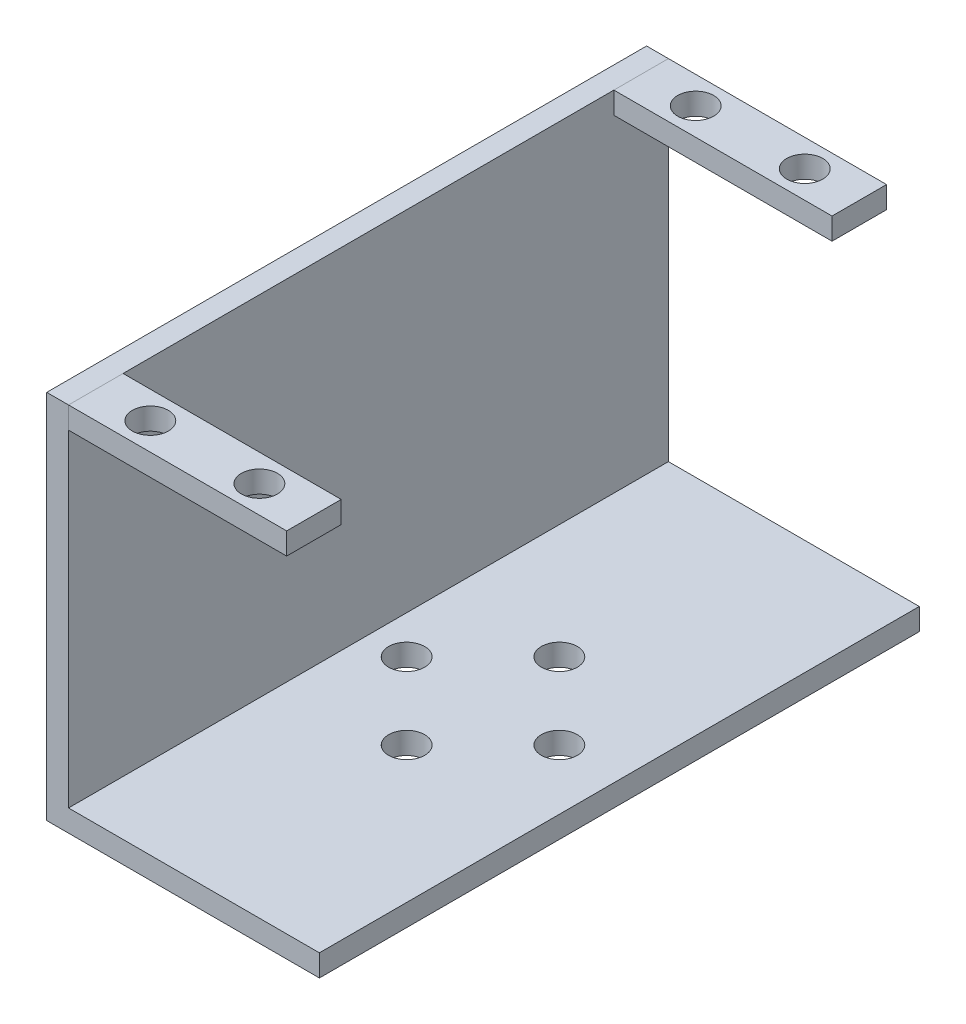
from build123d import *

# Parameters (mm, degrees)
SKETCH_1_W          = 25
SKETCH_1_H          = 55
EXTRUDE_1_DEPTH     = 2
SKETCH_2_R          = 1.65
CUT_EXTRUDE_1_DEPTH = 2
SKETCH_3_W          = 2
SKETCH_3_H          = 55
EXTRUDE_2_DEPTH     = 32
SKETCH_4_W          = 5
SKETCH_4_H          = 2
EXTRUDE_3_DEPTH     = 20
EXTRUDE_3_2_DEPTH   = 20
SKETCH_5_R          = 1.65
CUT_EXTRUDE_2_DEPTH = 2


with BuildPart() as part:
    # 草图1 → 凸台-拉伸1 (new body)
    with BuildSketch(Plane(origin=(0, 0, 0), x_dir=(1, 0, 0), z_dir=(0, 1, 0))):
        Rectangle(SKETCH_1_W, SKETCH_1_H)
    extrude(amount=EXTRUDE_1_DEPTH)

    # 草图2 → 切除-拉伸1 (cut)
    with BuildSketch(Plane(origin=(0, 2, 0), x_dir=(1, 0, 0), z_dir=(0, 1, 0))):
        with Locations(Location((7, 0, 0), (0, 0, 270))):
            Circle(SKETCH_2_R)
        with Locations(Location((0, 7, 0), (0, 0, 270))):
            Circle(SKETCH_2_R)
        with Locations(Location((-7, 0, 0), (0, 0, 270))):
            Circle(SKETCH_2_R)
        with Locations(Location((0, -7, 0), (0, 0, 270))):
            Circle(SKETCH_2_R)
    extrude(amount=-CUT_EXTRUDE_1_DEPTH, mode=Mode.SUBTRACT)

    # 草图3 → 凸台-拉伸2 (add)
    with BuildSketch(Plane(origin=(0, 2, 0), x_dir=(1, 0, 0), z_dir=(0, 1, 0))):
        with Locations((-11.5, 0)):
            Rectangle(SKETCH_3_W, SKETCH_3_H)
    extrude(amount=EXTRUDE_2_DEPTH)


with BuildPart() as body_2:
    # 草图4 → 凸台-拉伸3 (new body)
    with BuildSketch(Plane(origin=(-10.5, 0, 0), x_dir=(0, 0, -1), z_dir=(1, 0, 0))):
        with Locations((25, 33)):
            Rectangle(SKETCH_4_W, SKETCH_4_H)
    extrude(amount=EXTRUDE_3_DEPTH)


with BuildPart() as body_3:
    # 草图4 → Extrude 3 2 (new body)
    with BuildSketch(Plane(origin=(-10.5, 0, 0), x_dir=(0, 0, -1), z_dir=(1, 0, 0))):
        with Locations((-25, 33)):
            Rectangle(SKETCH_4_W, SKETCH_4_H)
    extrude(amount=EXTRUDE_3_2_DEPTH)


with BuildPart() as cut_extrude_2_tool:
    # 草图5 → 切除-拉伸2 (new body)
    with BuildSketch(Plane(origin=(0, 34, 0), x_dir=(1, 0, 0), z_dir=(0, 1, 0))):
        with Locations(Location((-5.5, -25, 0), (0, 0, 270))):
            Circle(SKETCH_5_R)
        with Locations(Location((4.5, -25, 0), (0, 0, 270))):
            Circle(SKETCH_5_R)
        with Locations(Location((4.5, 25, 0), (0, 0, 270))):
            Circle(SKETCH_5_R)
        with Locations(Location((-5.5, 25, 0), (0, 0, 270))):
            Circle(SKETCH_5_R)
    extrude(amount=-CUT_EXTRUDE_2_DEPTH)


with BuildPart() as body_2_1:
    add(body_2.part)

    # 切除-拉伸2: cut by cut_extrude_2_tool
    add(cut_extrude_2_tool.part, mode=Mode.SUBTRACT)


with BuildPart() as body_3_1:
    add(body_3.part)

    # 切除-拉伸2: cut by cut_extrude_2_tool
    add(cut_extrude_2_tool.part, mode=Mode.SUBTRACT)


solid = Compound([part.part, body_2_1.part, body_3_1.part])
